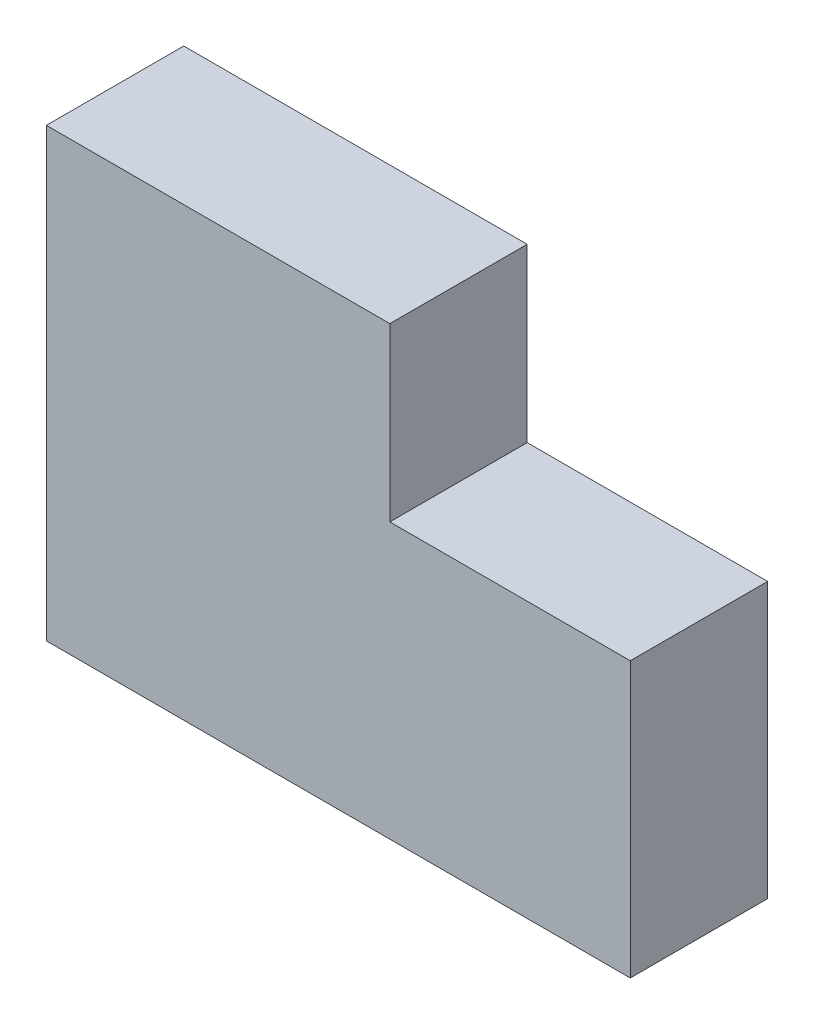
from build123d import *

# Parameters (mm, degrees)
BOSS_EXTRUDE1_DEPTH = 20


with BuildPart() as part:
    # Sketch1 → Boss-Extrude1 (new body)
    with BuildSketch(Plane.XY):
        Polygon((0, 0), (85, 0), (85, 40), (50, 40), (50, 65), (0, 65), align=None)
    extrude(amount=BOSS_EXTRUDE1_DEPTH)


solid = part.part
